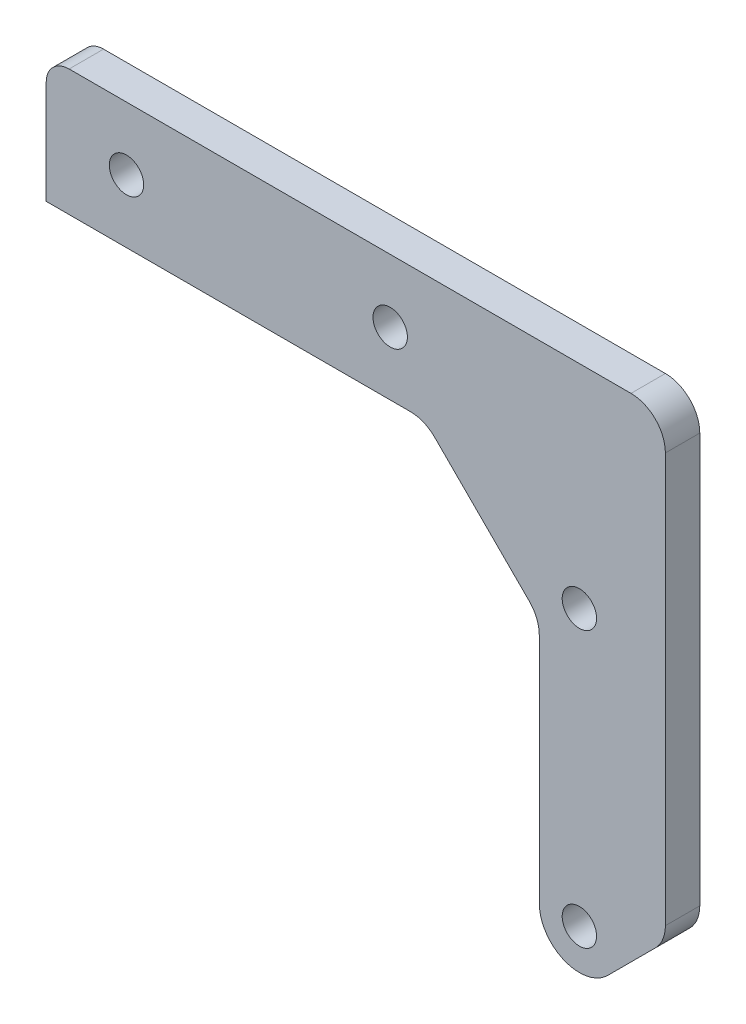
from build123d import *

# Parameters (mm, degrees)
SKETCH_1_R         = 1.5
EXTRUDE_1052_DEPTH = 3
FILLET1_R          = 3
FILLET_1_R         = 2


with BuildPart() as part:
    # Эскиз1 → Extrude 1052 (new body)
    with BuildSketch(Plane.XY):
        with BuildLine():
            Line((-48.5, 5.5), (-48.5, -5.5))
            Line((-48.5, -5.5), (-15.5, -5.5))
            Line((-15.5, -5.5), (-5.5, -15.5))
            Line((-5.5, -15.5), (-5.5, -37))
            ThreePointArc((-5.5, -37), (-3.339392013, -40.233578364), (0.474873734, -39.474873734))
            Line((0.474873734, -39.474873734), (5.5, -34.449747468))
            Line((5.5, -34.449747468), (5.5, 5.5))
            Line((5.5, 5.5), (-48.5, 5.5))
        make_face()
        with Locations((-18.5, 0)):
            Circle(SKETCH_1_R, mode=Mode.SUBTRACT)
        with Locations((-41.5, 0)):
            Circle(SKETCH_1_R, mode=Mode.SUBTRACT)
        with Locations((-2, -13)):
            Circle(SKETCH_1_R, mode=Mode.SUBTRACT)
        with Locations((-2, -37)):
            Circle(SKETCH_1_R, mode=Mode.SUBTRACT)
    extrude(amount=EXTRUDE_1052_DEPTH)

    # Fillet1
    fillet1_edges = [part.edges().sort_by_distance(p)[0] for p in [
        (-15.5, -5.5, 1.5),
        (-5.5, -15.5, 1.5),
        (5.5, -34.449747468, 1.5),
        (5.5, 5.5, 1.5),
    ]]
    fillet(fillet1_edges, radius=FILLET1_R)

    # Скругление1
    fillet_1_edges = [part.edges().sort_by_distance(p)[0] for p in [
        (-48.5, 5.5, 1.5),
    ]]
    fillet(fillet_1_edges, radius=FILLET_1_R)


solid = part.part
